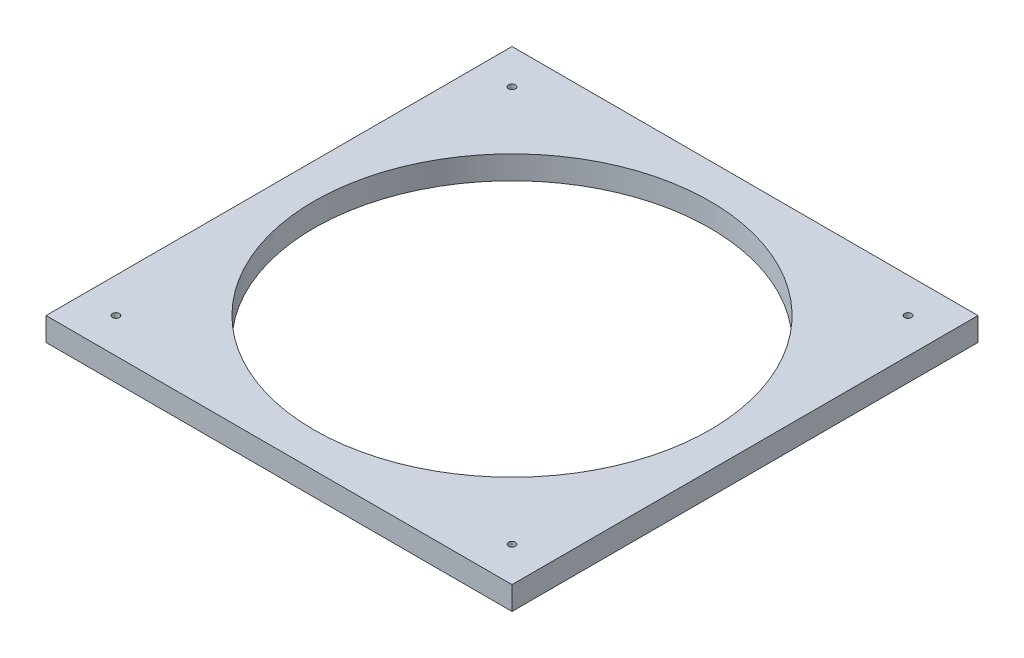
from build123d import *

# Parameters (mm, degrees)
SKETCH1_W           = 400
SKETCH1_H           = 400
SKETCH1_R           = 170
SKETCH1_R_2         = 3
BOSS_EXTRUDE1_DEPTH = 20


with BuildPart() as part:
    # Sketch1 → Boss-Extrude1 (new body)
    with BuildSketch(Plane(origin=(0, 0, 0), x_dir=(1, 0, 0), z_dir=(0, 1, 0))):
        Rectangle(SKETCH1_W, SKETCH1_H)
        with Locations(Location((0, 0, 0), (0, 0, 270))):
            Circle(SKETCH1_R, mode=Mode.SUBTRACT)
        with Locations(Location((-170, 170, 0), (0, 0, 270))):
            Circle(SKETCH1_R_2, mode=Mode.SUBTRACT)
        with Locations(Location((170, 170, 0), (0, 0, 270))):
            Circle(SKETCH1_R_2, mode=Mode.SUBTRACT)
        with Locations(Location((170, -170, 0), (0, 0, 270))):
            Circle(SKETCH1_R_2, mode=Mode.SUBTRACT)
        with Locations(Location((-170, -170, 0), (0, 0, 270))):
            Circle(SKETCH1_R_2, mode=Mode.SUBTRACT)
    extrude(amount=BOSS_EXTRUDE1_DEPTH)


solid = part.part
